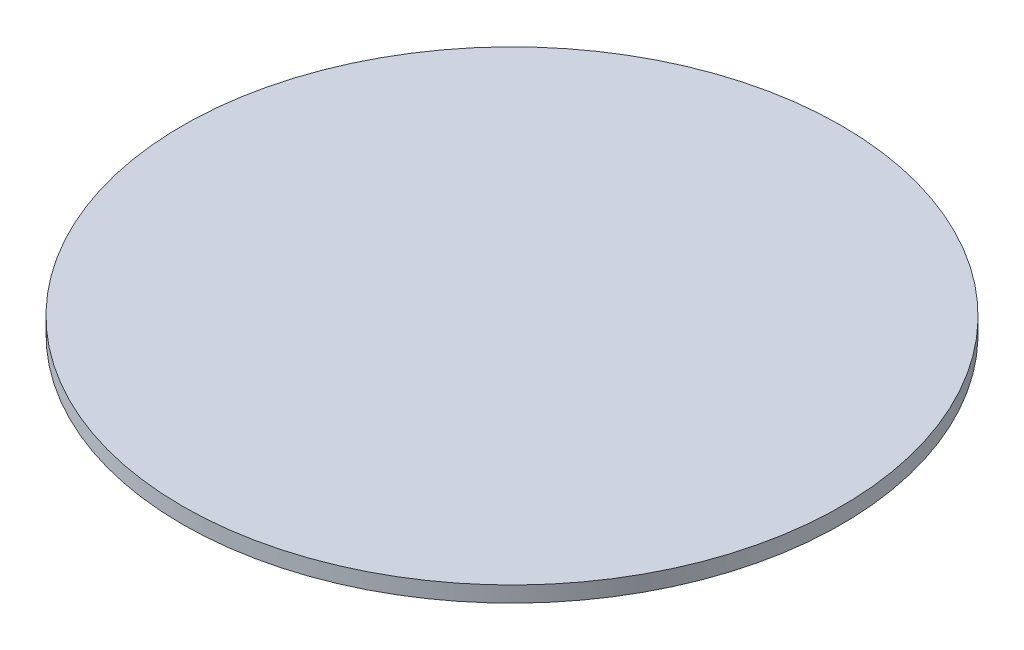
from build123d import *

# Parameters (mm, degrees)
FRONT_W       = 20.95
FRONT_H       = 1
SKETCH1_W     = 4
SKETCH1_H     = 1
HOLDERS_DEPTH = 1.8


with BuildPart() as part:
    # Front → Base (revolve)
    with BuildSketch(Plane.XY, mode=Mode.PRIVATE) as base_sk:
        with Locations((-10.475, 0)):
            Rectangle(FRONT_W, FRONT_H)
    revolve(base_sk.sketch.rotate(Axis((0, 0, 0), (0, 1, 0)), 270), axis=Axis((0, 0, 0), (0, 1, 0)))

    # Sketch1 → Holders (add)
    with BuildSketch(Plane.XZ.offset(0.5)):
        with Locations((0, 15)):
            Rectangle(SKETCH1_W, SKETCH1_H)
        with Locations((0, -15)):
            Rectangle(SKETCH1_W, SKETCH1_H)
    extrude(amount=HOLDERS_DEPTH)


solid = part.part
